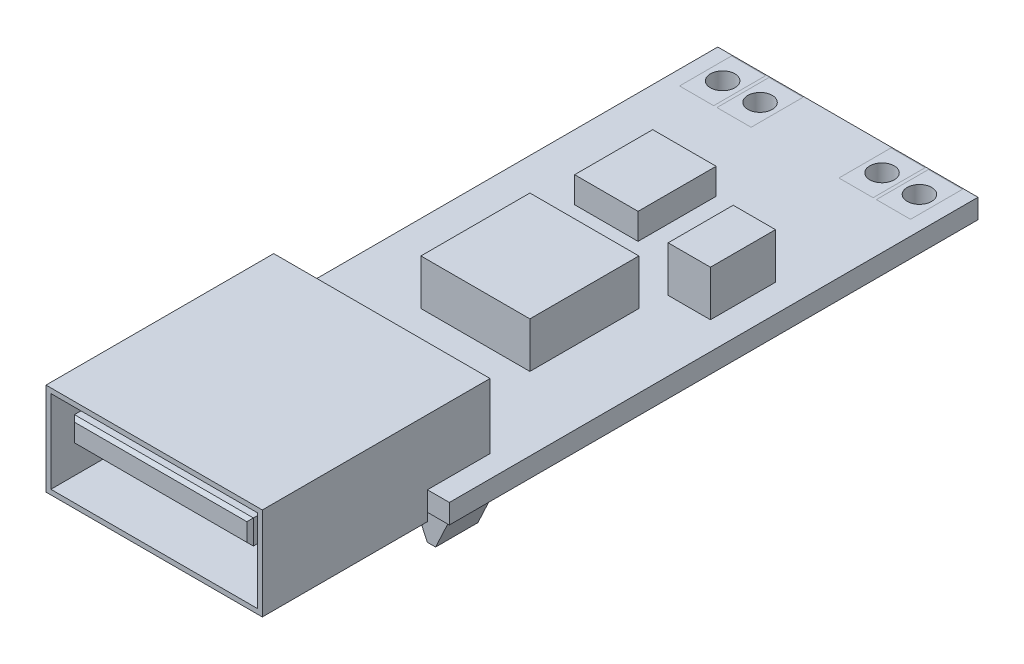
from build123d import *
from OCP.BRepFilletAPI import BRepFilletAPI_MakeChamfer

# Parameters (mm, degrees)
SCHIZZO1_W                   = 16
SCHIZZO1_H                   = 32.5
ESTRUSIONE_ESTRUSIONE1_DEPTH = 1.2
ESTRUSIONE_ESTRUSIONE2_DEPTH = 6.65
SVUOTA1_T                    = -0.3
SCHIZZO4_W                   = 11
SCHIZZO4_H                   = 1.5
ESTRUSIONE_ESTRUSIONE3_DEPTH = 13.3
SMUSSO1_SIZE                 = 0.2
SCHIZZO5_W                   = 2
SCHIZZO5_H                   = 2.6
ESTRUSIONE_ESTRUSIONE4_DEPTH = 2
SMUSSO2_SIZE                 = 1.6
SMUSSO2_SIZE2                = 0.746092253
SCHIZZO6_W                   = 6.7
SCHIZZO6_H                   = 6.7
SCHIZZO6_W_2                 = 2.6
SCHIZZO6_H_2                 = 4
ESTRUSIONE_ESTRUSIONE5_DEPTH = 2.8
SCHIZZO7_W                   = 3.9
SCHIZZO7_H                   = 4.8
ESTRUSIONE_ESTRUSIONE6_DEPTH = 1.6
SCHIZZO9_R                   = 0.75
TAGLIO_ESTRUSIONE1_DEPTH     = 28.874002224


with BuildPart() as part:
    # Schizzo1 → Estrusione-Estrusione1 (new body)
    with BuildSketch(Plane(origin=(0, 0, 0), x_dir=(1, 0, 0), z_dir=(0, 1, 0))):
        Rectangle(SCHIZZO1_W, SCHIZZO1_H)
    extrude(amount=ESTRUSIONE_ESTRUSIONE1_DEPTH)

    # Schizzo5 → Estrusione-Estrusione4 (add)
    with BuildSketch(Plane.XZ):
        with Locations((-6.5, 14.55)):
            Rectangle(SCHIZZO5_W, SCHIZZO5_H)
        with Locations((6.5, 14.55)):
            Rectangle(SCHIZZO5_W, SCHIZZO5_H)
    extrude(amount=ESTRUSIONE_ESTRUSIONE4_DEPTH)

    # Smusso2: one chamfer whose edges measure the first distance from different faces: ONE call of the kernel's chamfer builder (chamfer() names one face for all edges)
    smusso2_edges_1 = [part.edges().sort_by_distance(p)[0] for p in [
        (-5.5, -2, 14.55),
    ]]
    smusso2_side_1 = [part.faces().sort_by_distance(p)[0] for p in [
        (-5.5, -1, 14.55),
    ]]
    smusso2_edges_2 = [part.edges().sort_by_distance(p)[0] for p in [
        (-7.5, -2, 14.55),
    ]]
    smusso2_side_2 = [part.faces().sort_by_distance(p)[0] for p in [
        (-7.5, -1, 14.55),
    ]]
    smusso2_edges_3 = [part.edges().sort_by_distance(p)[0] for p in [
        (7.5, -2, 14.55),
    ]]
    smusso2_side_3 = [part.faces().sort_by_distance(p)[0] for p in [
        (7.5, -1, 14.55),
    ]]
    smusso2_edges_4 = [part.edges().sort_by_distance(p)[0] for p in [
        (5.5, -2, 14.55),
    ]]
    smusso2_side_4 = [part.faces().sort_by_distance(p)[0] for p in [
        (5.5, -1, 14.55),
    ]]
    smusso2 = BRepFilletAPI_MakeChamfer(part.part.solid().wrapped)
    for e in smusso2_edges_1:
        smusso2.Add(SMUSSO2_SIZE, SMUSSO2_SIZE2, e.wrapped, smusso2_side_1[0].wrapped)  # the first distance lies on this face
    for e in smusso2_edges_2:
        smusso2.Add(SMUSSO2_SIZE, SMUSSO2_SIZE2, e.wrapped, smusso2_side_2[0].wrapped)  # the first distance lies on this face
    for e in smusso2_edges_3:
        smusso2.Add(SMUSSO2_SIZE, SMUSSO2_SIZE2, e.wrapped, smusso2_side_3[0].wrapped)  # the first distance lies on this face
    for e in smusso2_edges_4:
        smusso2.Add(SMUSSO2_SIZE, SMUSSO2_SIZE2, e.wrapped, smusso2_side_4[0].wrapped)  # the first distance lies on this face
    add(Compound.cast(smusso2.Shape()), mode=Mode.REPLACE)

    # Schizzo6 → Estrusione-Estrusione5 (add)
    with BuildSketch(Plane(origin=(0, 1.2, 0), x_dir=(1, 0, 0), z_dir=(0, 1, 0))):
        with Locations((0.15, -3.45)):
            Rectangle(SCHIZZO6_W, SCHIZZO6_H)
        with Locations((5, 3.5)):
            Rectangle(SCHIZZO6_W_2, SCHIZZO6_H_2)
    extrude(amount=ESTRUSIONE_ESTRUSIONE5_DEPTH)

    # Schizzo7 → Estrusione-Estrusione6 (add)
    with BuildSketch(Plane(origin=(0, 1.2, 0), x_dir=(1, 0, 0), z_dir=(0, 1, 0))):
        with Locations((-2.05, 5.85)):
            Rectangle(SCHIZZO7_W, SCHIZZO7_H)
    extrude(amount=ESTRUSIONE_ESTRUSIONE6_DEPTH)

    # Schizzo9 → Taglio-Estrusione1 (cut, through all)
    with BuildSketch(Plane(origin=(0, 1.2, 0), x_dir=(1, 0, 0), z_dir=(0, 1, 0))):
        with Locations(Location((-6.05, 14.6, 0), (0, 0, 270))):
            Circle(SCHIZZO9_R)
        with Locations(Location((-3.75, 14.6, 0), (0, 0, 270))):
            Circle(SCHIZZO9_R)
        with Locations(Location((3.75, 14.6, 0), (0, 0, 270))):
            Circle(SCHIZZO9_R)
        with Locations(Location((6.05, 14.6, 0), (0, 0, 270))):
            Circle(SCHIZZO9_R)
    extrude(amount=-TAGLIO_ESTRUSIONE1_DEPTH, mode=Mode.SUBTRACT)


with BuildPart() as body_2:
    # Schizzo3 → Estrusione-Estrusione2 (new, symmetric)
    with BuildSketch(Plane(origin=(0, 0, 0), x_dir=(0, 0, -1), z_dir=(1, 0, 0))):
        Polygon((-26.4, -0.5), (-26.4, 5.2), (-12.4, 5.2), (-12.4, 1.2), (-16.25, 1.2), (-16.25, -0.5), align=None)
    extrude(amount=ESTRUSIONE_ESTRUSIONE2_DEPTH, both=True)

    # Svuota1
    svuota1_openings = [body_2.faces().sort_by_distance(p)[0] for p in [
        (0, 2.35, 26.4),
    ]]
    offset(amount=SVUOTA1_T, openings=svuota1_openings, kind=Kind.INTERSECTION)

    # Schizzo4 → Estrusione-Estrusione3 (add)
    with BuildSketch(Plane.XY.offset(12.7)):
        with Locations((0, 3.15)):
            Rectangle(SCHIZZO4_W, SCHIZZO4_H)
    extrude(amount=ESTRUSIONE_ESTRUSIONE3_DEPTH)

    # Smusso1
    smusso1_edges = [body_2.edges().sort_by_distance(p)[0] for p in [
        (-5.5, 3.15, 26),
        (0, 2.4, 26),
        (5.5, 3.15, 26),
        (0, 3.9, 26),
    ]]
    chamfer(smusso1_edges, length=SMUSSO1_SIZE)


solid = Compound([part.part, body_2.part])
